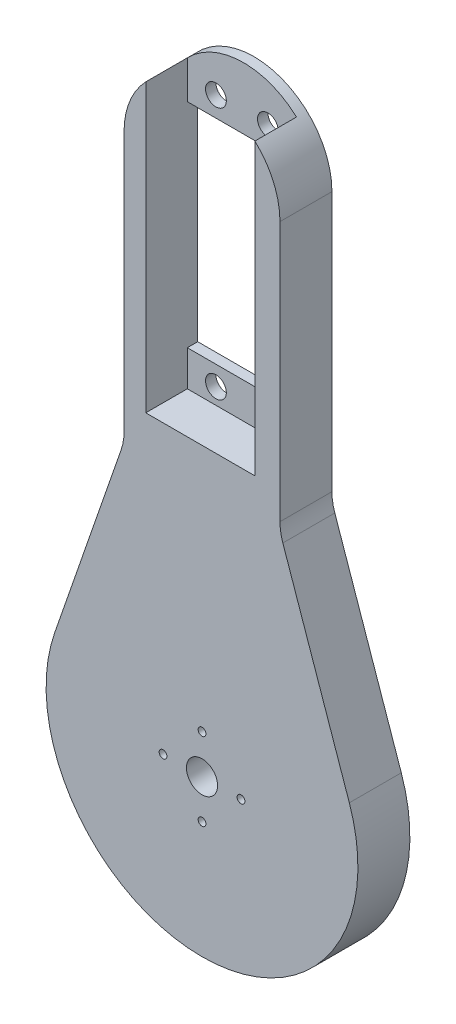
from build123d import *

# Parameters (mm, degrees)
ESQUISSE1_W        = 21
ESQUISSE1_H        = 41
ESQUISSE1_R        = 0.75
ESQUISSE1_R_2      = 2
ESQUISSE1_R_3      = 3
BOSS_EXTRU_1_DEPTH = 2
BOSS_EXTRU_2_START = 2
ESQUISSE1_3_R      = 0.75
ESQUISSE1_3_R_2    = 3
BOSS_EXTRU_2_DEPTH = 8


with BuildPart() as part:
    # Esquisse1 → Boss.-Extru.1 (new body)
    with BuildSketch(Plane.XY):
        with BuildLine():
            Line((-15, 100), (-15, 50))
            ThreePointArc((-15, 50), (-15.138914933, 48.338975829), (-15.551800259, 46.72409987))
            Line((-15.551800259, 46.72409987), (-28.344599222, 9.827700389))
            ThreePointArc((-28.344599222, 9.827700389), (0, -30), (28.344599222, 9.827700389))
            Line((28.344599222, 9.827700389), (15.551800259, 46.72409987))
            ThreePointArc((15.551800259, 46.72409987), (15.138914933, 48.338975829), (15, 50))
            Line((15, 50), (15, 100))
            ThreePointArc((15, 100), (0, 115), (-15, 100))
        make_face()
        with Locations((-0.323225061, 82.579304785)):
            Rectangle(ESQUISSE1_W, ESQUISSE1_H, mode=Mode.SUBTRACT)
        with Locations((0, -7.5)):
            Circle(ESQUISSE1_R, mode=Mode.SUBTRACT)
        with Locations((-7.5, 0)):
            Circle(ESQUISSE1_R, mode=Mode.SUBTRACT)
        with Locations((0, 7.5)):
            Circle(ESQUISSE1_R, mode=Mode.SUBTRACT)
        with Locations((7.5, 0)):
            Circle(ESQUISSE1_R, mode=Mode.SUBTRACT)
        with Locations((4.676774939, 106.958577425)):
            Circle(ESQUISSE1_R_2, mode=Mode.SUBTRACT)
        with Locations((-5.323225061, 106.958577425)):
            Circle(ESQUISSE1_R_2, mode=Mode.SUBTRACT)
        with Locations((4.676774939, 58.328577425)):
            Circle(ESQUISSE1_R_2, mode=Mode.SUBTRACT)
        with Locations((-5.323225061, 58.328577425)):
            Circle(ESQUISSE1_R_2, mode=Mode.SUBTRACT)
        Circle(ESQUISSE1_R_3, mode=Mode.SUBTRACT)
    extrude(amount=BOSS_EXTRU_1_DEPTH)

    # Esquisse1<3> → Boss.-Extru.2 (add)
    with BuildSketch(Plane.XY.offset(BOSS_EXTRU_2_START)):
        with BuildLine():
            ThreePointArc((-10.823225061, 110.385460957), (-13.916687392, 105.596946672), (-15, 100))
            Line((-15, 100), (-15, 50))
            ThreePointArc((-15, 50), (-15.138914933, 48.338975829), (-15.551800259, 46.72409987))
            Line((-15.551800259, 46.72409987), (-28.344599222, 9.827700389))
            ThreePointArc((-28.344599222, 9.827700389), (0, -30), (28.344599222, 9.827700389))
            Line((28.344599222, 9.827700389), (15.551800259, 46.72409987))
            ThreePointArc((15.551800259, 46.72409987), (15.138914933, 48.338975829), (15, 50))
            Line((15, 50), (15, 100))
            ThreePointArc((15, 100), (13.74139047, 106.014498147), (10.176774939, 111.019675668))
            Line((10.176774939, 111.019675668), (10.176774939, 55.229304785))
            Line((10.176774939, 55.229304785), (-10.823225061, 55.229304785))
            Line((-10.823225061, 55.229304785), (-10.823225061, 110.385460957))
        make_face()
        with Locations((0, -7.5)):
            Circle(ESQUISSE1_3_R, mode=Mode.SUBTRACT)
        with Locations((7.5, 0)):
            Circle(ESQUISSE1_3_R, mode=Mode.SUBTRACT)
        with Locations((0, 7.5)):
            Circle(ESQUISSE1_3_R, mode=Mode.SUBTRACT)
        with Locations((-7.5, 0)):
            Circle(ESQUISSE1_3_R, mode=Mode.SUBTRACT)
        Circle(ESQUISSE1_3_R_2, mode=Mode.SUBTRACT)
    extrude(amount=BOSS_EXTRU_2_DEPTH)


solid = part.part
